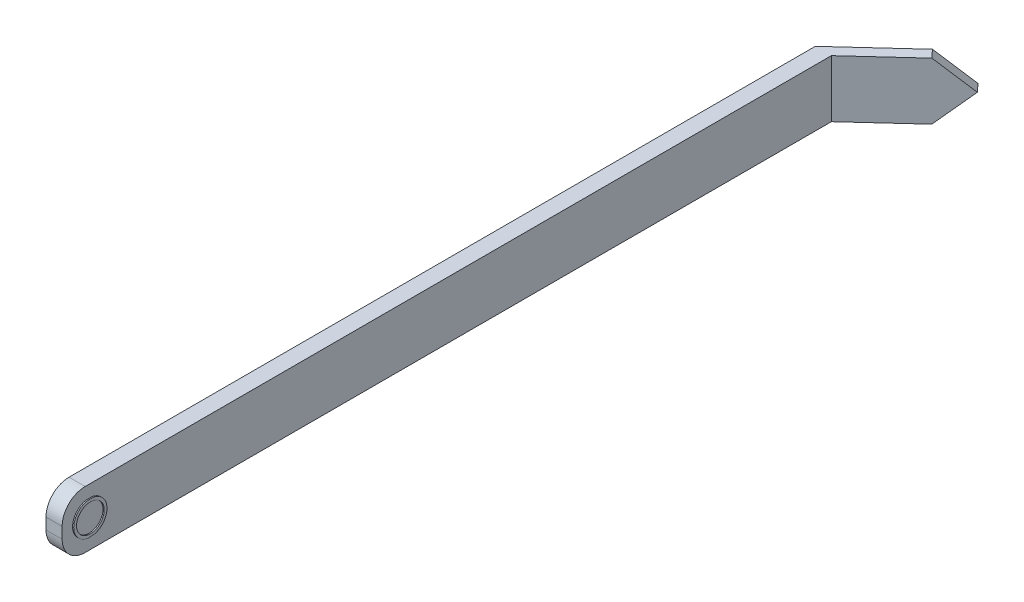
from build123d import *

# Parameters (mm, degrees)
SKETCH1_W               = 167
SKETCH1_H               = 12.42
BOSS_EXTRUDE1_DEPTH     = 3.5
SKETCH7_R               = 3
CUT_EXTRUDE1_DEPTH      = 188.444675571
CUT_EXTRUDE2_DEPTH      = 1.8
FILLET1_R               = 5
FILLET2_R               = 2
BOSS_EXTRUDE2_START     = -3.5
SKETCH7_5_R             = 3
BOSS_EXTRUDE2_DEPTH     = 0.25
CUT_EXTRUDE5_DEPTH      = 188.449510269
CUT_EXTRUDE5_DEPTH_BACK = 188.449510269
BOSS_EXTRUDE3_DEPTH     = 12.42
CUT_EXTRUDE7_DEPTH      = 140.602620265
CUT_EXTRUDE7_DEPTH_BACK = 140.602620265


with BuildPart() as part:
    # Sketch1 → Boss-Extrude1 (new body)
    with BuildSketch(Plane(origin=(0, 0, 0), x_dir=(0, 0, -1), z_dir=(1, 0, 0))):
        with Locations((83.5, 6.21)):
            Rectangle(SKETCH1_W, SKETCH1_H)
        Polygon((180, 0), (167, 0), (167, 12.42), (180, 12.42), (187, 6.21), align=None)
    extrude(amount=BOSS_EXTRUDE1_DEPTH)

    # Sketch7 → Cut-Extrude1 (cut, through all)
    with BuildSketch(Plane.ZY):
        with BuildLine():
            ThreePointArc((-2.27, 6.21), (-3.168108515, 8.592801832), (-5.415564859, 9.79))
            Line((-5.415564859, 9.79), (-6.76734979, 9.709244254))
            ThreePointArc((-6.76734979, 9.709244254), (-9.49, 6.21), (-6.76734979, 2.710755746))
            Line((-6.76734979, 2.710755746), (-5.415564859, 2.63))
            ThreePointArc((-5.415564859, 2.63), (-3.168108515, 3.827198168), (-2.27, 6.21))
        make_face()
        with Locations((-5.88, 6.21)):
            Circle(SKETCH7_R, mode=Mode.SUBTRACT)
    extrude(amount=-CUT_EXTRUDE1_DEPTH, mode=Mode.SUBTRACT)


with BuildPart() as cut_extrude1_piece_1:
    # of the separate pieces the step leaves, piece 1, a body of its own (cut_extrude1_pieces)
    add(part.part.solids().sort_by_distance((0, 0, 0))[0])

    # Sketch7<3> → Cut-Extrude2 (cut)
    with BuildSketch(Plane.ZY):
        with BuildLine():
            ThreePointArc((-6.76734979, 2.710755746), (-9.49, 6.21), (-6.76734979, 9.709244254))
            Line((-6.76734979, 9.709244254), (-23.410182873, 8.715))
            ThreePointArc((-23.410182873, 8.715), (-25.77, 6.21), (-23.410182873, 3.705))
            Line((-23.410182873, 3.705), (-6.76734979, 2.710755746))
        make_face()
    extrude(amount=-CUT_EXTRUDE2_DEPTH, mode=Mode.SUBTRACT)

    # Fillet1
    fillet1_edges = [cut_extrude1_piece_1.edges().sort_by_distance(p)[0] for p in [
        (1.75, 0, 0),
        (1.75, 12.42, 0),
    ]]
    fillet(fillet1_edges, radius=FILLET1_R)

    # Fillet2
    fillet2_edges = [cut_extrude1_piece_1.edges().sort_by_distance(p)[0] for p in [
        (2.65, 9.709244254, -6.76734979),
        (2.65, 2.710755746, -6.76734979),
    ]]
    fillet(fillet2_edges, radius=FILLET2_R)

    # Sketch1<4> → Cut-Extrude5 (cut, two sides: drawn at the far end of the back side and taken through both)
    with BuildSketch(Plane(origin=(0, 0, 0), x_dir=(0, 0, -1), z_dir=(1, 0, 0)).offset(-CUT_EXTRUDE5_DEPTH_BACK)):
        Polygon((180, 0), (167, 0), (167, 12.42), (180, 12.42), (187, 6.21), align=None)
    extrude(amount=CUT_EXTRUDE5_DEPTH + CUT_EXTRUDE5_DEPTH_BACK, mode=Mode.SUBTRACT)

    # Sketch8 → Boss-Extrude3 (add)
    with BuildSketch(Plane(origin=(0, 12.42, 0), x_dir=(1, 0, 0), z_dir=(0, 1, 0))):
        Polygon((3.5, 167), (20.024731229, 182.152741342), (18.426036661, 183.89618812), (0, 167), align=None)
    extrude(amount=-BOSS_EXTRUDE3_DEPTH)

    # Sketch9 → Cut-Extrude7 (cut, two sides: drawn at the far end of the back side and taken through both)
    with BuildSketch(Plane(origin=(-83.187317676, 0, -90.71943058), x_dir=(-0.737041466427066, 0, 0.6758475247916796), z_dir=(-0.6758475247916796, 0, -0.737041466427066)).offset(-CUT_EXTRUDE7_DEPTH_BACK)):
        Polygon((-137.86653664, 12.42), (-137.86653664, 6.21), (-130.86653664, 12.42), align=None)
        Polygon((-130.86653664, 0), (-137.86653664, 6.21), (-137.86653664, 0), align=None)
    extrude(amount=CUT_EXTRUDE7_DEPTH + CUT_EXTRUDE7_DEPTH_BACK, mode=Mode.SUBTRACT)


with BuildPart() as cut_extrude1_piece_2:
    # of the separate pieces the step leaves, piece 2, a body of its own (cut_extrude1_pieces)
    add(part.part.solids().sort_by_distance((3.5, 6.21, -2.88))[0])


with BuildPart() as body_3:
    # Sketch7<5> → Boss-Extrude2 (new body)
    with BuildSketch(Plane.ZY.offset(BOSS_EXTRUDE2_START)):
        with BuildLine():
            ThreePointArc((-2.27, 6.21), (-3.168108515, 8.592801832), (-5.415564859, 9.79))
            Line((-5.415564859, 9.79), (-6.76734979, 9.709244254))
            ThreePointArc((-6.76734979, 9.709244254), (-9.49, 6.21), (-6.76734979, 2.710755746))
            Line((-6.76734979, 2.710755746), (-5.415564859, 2.63))
            ThreePointArc((-5.415564859, 2.63), (-3.168108515, 3.827198168), (-2.27, 6.21))
        make_face()
        with Locations(Location((-5.88, 6.21, 0), (0, 0, 180))):
            Circle(SKETCH7_5_R, mode=Mode.SUBTRACT)
    extrude(amount=-BOSS_EXTRUDE2_DEPTH)


solid = Compound([cut_extrude1_piece_1.part, cut_extrude1_piece_2.part, body_3.part])
